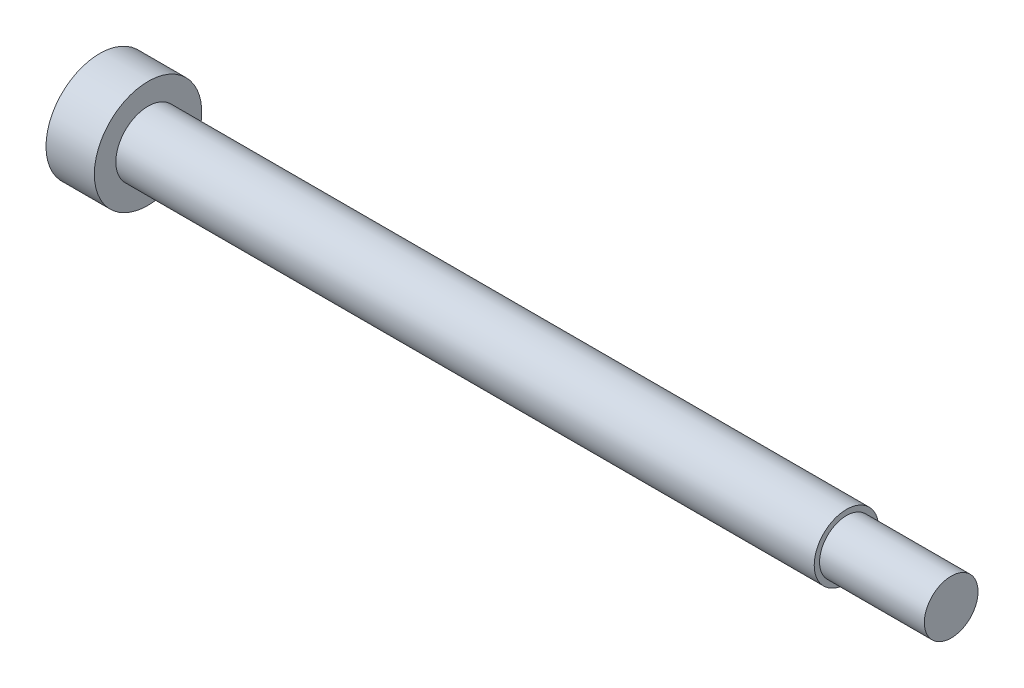
from build123d import *

# Parameters (mm, degrees)
CUT_EXTRUDE_1_DEPTH = 3


with BuildPart() as part:
    # 草图1 → 旋转1 (revolve)
    with BuildSketch(Plane.XY, mode=Mode.PRIVATE) as revolve_1_sk:
        Polygon((0, 0), (0, 5), (4.5, 5), (4.5, 3), (69.5, 3), (69.5, 2.5), (79.25, 2.5), (79.25, 0), align=None)
    revolve(revolve_1_sk.sketch.rotate(Axis((0, 0, 0), (1, 0, 0)), 90), axis=Axis((0, 0, 0), (1, 0, 0)))

    # 草图2 → 切除-拉伸1 (cut)
    with BuildSketch(Plane.ZY):
        Polygon((0, 2.886751346), (-2.5, 1.443375673), (-2.5, -1.443375673), (0, -2.886751346), (2.5, -1.443375673), (2.5, 1.443375673), align=None)
    extrude(amount=-CUT_EXTRUDE_1_DEPTH, mode=Mode.SUBTRACT)


solid = part.part
